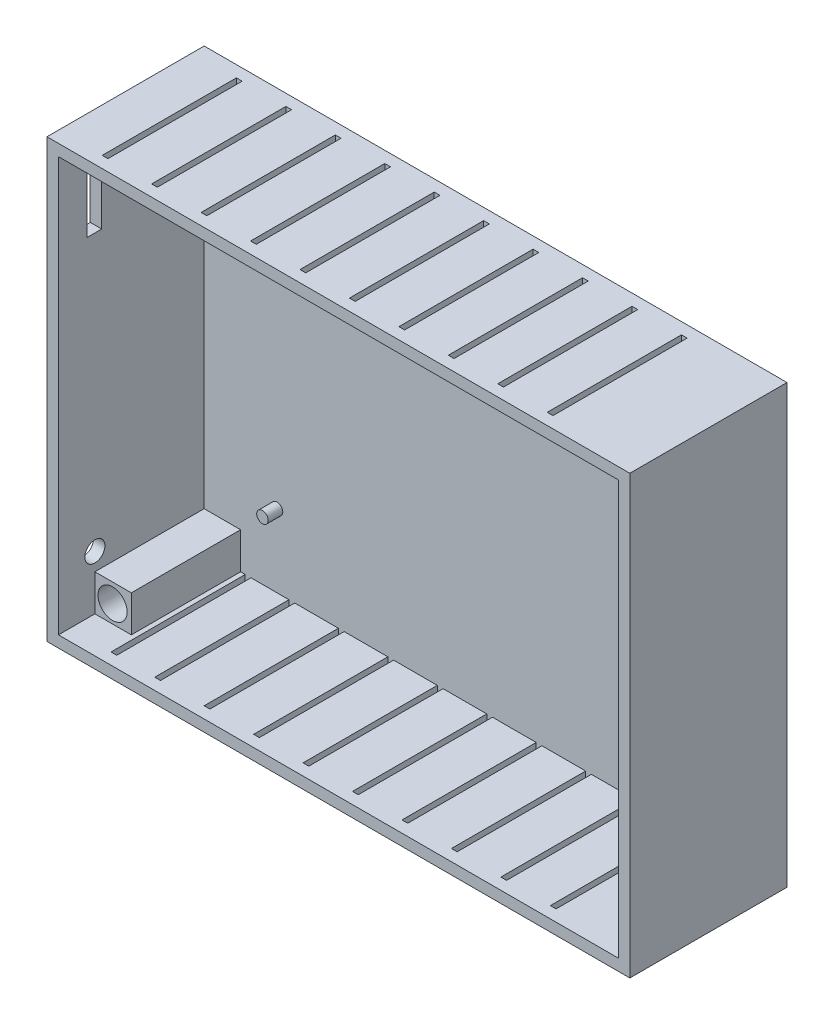
from build123d import *

# Parameters (mm, degrees)
SKETCH16_W          = 101.6
SKETCH16_H          = 76.2
BOSS_EXTRUDE4_DEPTH = 2
SKETCH17_W          = 101.6
SKETCH17_H          = 76.2
SKETCH17_W_2        = 97.6
SKETCH17_H_2        = 72.2
BOSS_EXTRUDE5_DEPTH = 25.4
SKETCH18_R          = 1
BOSS_EXTRUDE6_DEPTH = 2.54
SKETCH19_W          = 1
SKETCH19_H          = 23.4
CUT_EXTRUDE6_DEPTH  = 2
SKETCH20_W          = 1
SKETCH20_H          = 23.4
CUT_EXTRUDE7_DEPTH  = 2
SKETCH21_R          = 1.75
SKETCH21_W          = 2.54
SKETCH21_H          = 12.7
CUT_EXTRUDE8_DEPTH  = 2
SKETCH33_W          = 6.35
SKETCH33_H          = 6.35
SKETCH33_R          = 2.54
BOSS_EXTRUDE7_DEPTH = 19.05


with BuildPart() as part:
    # Sketch16 → Boss-Extrude4 (new body)
    with BuildSketch(Plane.XY):
        with Locations((50.8, -38.1)):
            Rectangle(SKETCH16_W, SKETCH16_H)
    extrude(amount=BOSS_EXTRUDE4_DEPTH)

    # Sketch17 → Boss-Extrude5 (add)
    with BuildSketch(Plane.XY.offset(2)):
        with Locations((50.8, -38.1)):
            Rectangle(SKETCH17_W, SKETCH17_H)
        with Locations((50.8, -38.1)):
            Rectangle(SKETCH17_W_2, SKETCH17_H_2, mode=Mode.SUBTRACT)
    extrude(amount=BOSS_EXTRUDE5_DEPTH)

    # Sketch18 → Boss-Extrude6 (add)
    with BuildSketch(Plane.XY.offset(2)):
        with Locations((14.7, -14.7)):
            Circle(SKETCH18_R)
        with Locations((86.9, -14.7)):
            Circle(SKETCH18_R)
        with Locations((86.9, -61.5)):
            Circle(SKETCH18_R)
        with Locations((14.7, -61.5)):
            Circle(SKETCH18_R)
    extrude(amount=BOSS_EXTRUDE6_DEPTH)

    # Sketch19 → Cut-Extrude6 (cut)
    with BuildSketch(Plane.XZ.offset(76.2)):
        with Locations((9.66, 13.7)):
            Rectangle(SKETCH19_W, SKETCH19_H)
        with Locations((17.28, 13.7)):
            Rectangle(SKETCH19_W, SKETCH19_H)
        with Locations((25.9, 13.7)):
            Rectangle(SKETCH19_W, SKETCH19_H)
        with Locations((34.52, 13.7)):
            Rectangle(SKETCH19_W, SKETCH19_H)
        with Locations((43.14, 13.7)):
            Rectangle(SKETCH19_W, SKETCH19_H)
        with Locations((51.76, 13.7)):
            Rectangle(SKETCH19_W, SKETCH19_H)
        with Locations((60.38, 13.7)):
            Rectangle(SKETCH19_W, SKETCH19_H)
        with Locations((69, 13.7)):
            Rectangle(SKETCH19_W, SKETCH19_H)
        with Locations((77.62, 13.7)):
            Rectangle(SKETCH19_W, SKETCH19_H)
        with Locations((86.24, 13.7)):
            Rectangle(SKETCH19_W, SKETCH19_H)
    extrude(amount=-CUT_EXTRUDE6_DEPTH, mode=Mode.SUBTRACT)

    # Sketch20 → Cut-Extrude7 (cut)
    with BuildSketch(Plane(origin=(0, 0, 0), x_dir=(1, 0, 0), z_dir=(0, 1, 0))):
        with Locations((8.12, -13.7)):
            Rectangle(SKETCH20_W, SKETCH20_H)
        with Locations((16.74, -13.7)):
            Rectangle(SKETCH20_W, SKETCH20_H)
        with Locations((25.36, -13.7)):
            Rectangle(SKETCH20_W, SKETCH20_H)
        with Locations((33.98, -13.7)):
            Rectangle(SKETCH20_W, SKETCH20_H)
        with Locations((42.6, -13.7)):
            Rectangle(SKETCH20_W, SKETCH20_H)
        with Locations((51.22, -13.7)):
            Rectangle(SKETCH20_W, SKETCH20_H)
        with Locations((59.84, -13.7)):
            Rectangle(SKETCH20_W, SKETCH20_H)
        with Locations((68.46, -13.7)):
            Rectangle(SKETCH20_W, SKETCH20_H)
        with Locations((85.7, -13.7)):
            Rectangle(SKETCH20_W, SKETCH20_H)
        with Locations((77.08, -13.7)):
            Rectangle(SKETCH20_W, SKETCH20_H)
    extrude(amount=-CUT_EXTRUDE7_DEPTH, mode=Mode.SUBTRACT)

    # Sketch21 → Cut-Extrude8 (cut)
    with BuildSketch(Plane.ZY):
        with Locations(Location((21.05, -64.77, 0), (0, 0, 270))):
            Circle(SKETCH21_R)
        with Locations((21.13, -10.35)):
            Rectangle(SKETCH21_W, SKETCH21_H)
    extrude(amount=-CUT_EXTRUDE8_DEPTH, mode=Mode.SUBTRACT)

    # Sketch33 → Boss-Extrude7 (add)
    # profile 1 of 4: a face of its own
    with BuildSketch(Plane.XY.offset(2)):
        with Locations((5.175, -5.175)):
            Rectangle(SKETCH33_W, SKETCH33_H)
        with Locations(Location((5.08, -5.08, 0), (0, 0, 180))):
            Circle(SKETCH33_R, mode=Mode.SUBTRACT)
    # profile 2 of 4: a face of its own
    with BuildSketch(Plane.XY.offset(2)):
        with Locations((96.425, -5.175)):
            Rectangle(SKETCH33_W, SKETCH33_H)
        with Locations(Location((96.52, -5.08, 0), (0, 0, 180))):
            Circle(SKETCH33_R, mode=Mode.SUBTRACT)
    # profile 3 of 4: a face of its own
    with BuildSketch(Plane.XY.offset(2)):
        with Locations((5.175, -71.025)):
            Rectangle(SKETCH33_W, SKETCH33_H)
        with Locations(Location((5.08, -71.12, 0), (0, 0, 180))):
            Circle(SKETCH33_R, mode=Mode.SUBTRACT)
    # profile 4 of 4: a face of its own
    with BuildSketch(Plane.XY.offset(2)):
        with Locations((96.425, -71.025)):
            Rectangle(SKETCH33_W, SKETCH33_H)
        with Locations(Location((96.52, -71.12, 0), (0, 0, 180))):
            Circle(SKETCH33_R, mode=Mode.SUBTRACT)
    extrude(amount=BOSS_EXTRUDE7_DEPTH)


solid = part.part
